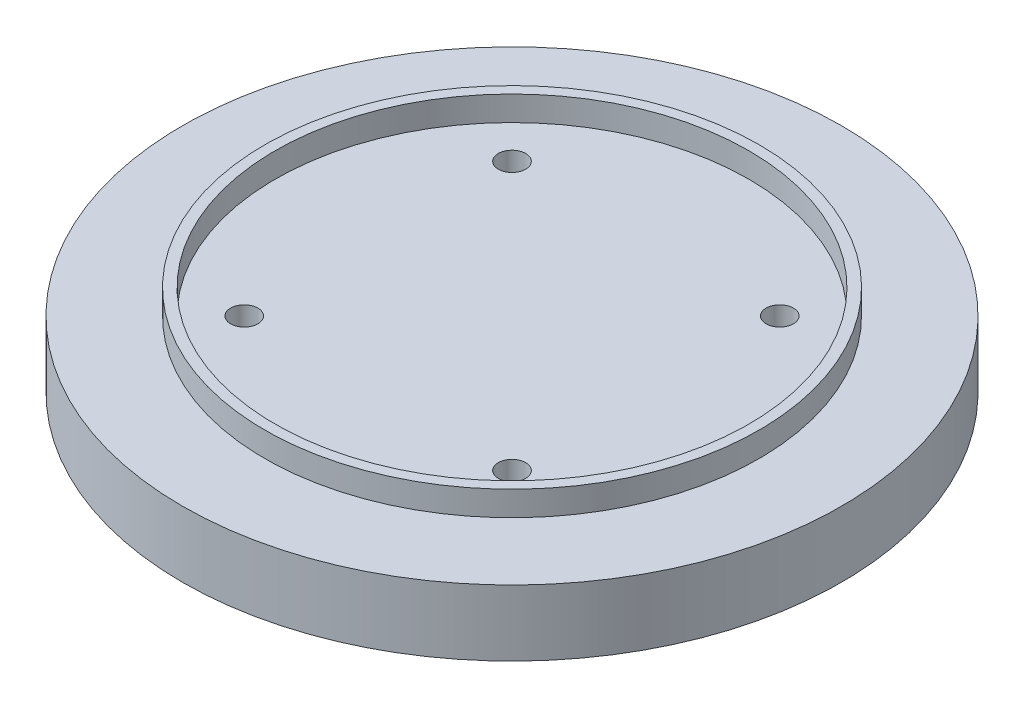
from build123d import *

# Parameters (mm, degrees)
SKETCH1_R                   = 101.6
BOSS_EXTRUDE1_DEPTH         = 10.16
F_3_8_24_TAPPED_HOLE2_D     = 8.4328
F_3_8_24_TAPPED_HOLE2_DEPTH = 13.462
F_3_8_24_TAPPED_HOLE2_TIP   = 2.533468714
F_3_8_24_TAPPED_HOLE1_D     = 8.4328
F_3_8_24_TAPPED_HOLE1_DEPTH = 14.224
F_3_8_24_TAPPED_HOLE1_TIP   = 2.533468714
SKETCH2_R                   = 76.2
SKETCH2_R_2                 = 73.025
BOSS_EXTRUDE2_DEPTH         = 7.62


with BuildPart() as part:
    # Sketch1 → Boss-Extrude1 (new, symmetric)
    with BuildSketch(Plane(origin=(0, 0, 0), x_dir=(1, 0, 0), z_dir=(0, 1, 0))):
        with Locations(Location((0, 0, 0), (0, 0, 270))):
            Circle(SKETCH1_R)
    extrude(amount=BOSS_EXTRUDE1_DEPTH, both=True)

    # 3/8-24 Tapped Hole2
    with Locations(Plane(origin=(0, 10.16, 0), x_dir=(1, 0, 0), z_dir=(0, 1, 0))):
        with Locations((-41.275, 41.275), (41.275, 41.275), (41.275, -41.275), (-41.275, -41.275)):
            Hole(F_3_8_24_TAPPED_HOLE2_D / 2, depth=F_3_8_24_TAPPED_HOLE2_DEPTH)
            with Locations((0, 0, -(F_3_8_24_TAPPED_HOLE2_DEPTH + F_3_8_24_TAPPED_HOLE2_TIP / 2))):  # 118° drill point
                Cone(0, F_3_8_24_TAPPED_HOLE2_D / 2, F_3_8_24_TAPPED_HOLE2_TIP, mode=Mode.SUBTRACT)

    # 3/8-24 Tapped Hole1
    with Locations(Plane(origin=(0, -10.16, 0), x_dir=(-1, 0, 0), z_dir=(0, -1, 0))):
        with Locations((50.8, -50.8), (-50.8, -50.8), (-50.8, 50.8), (50.8, 50.8)):
            Hole(F_3_8_24_TAPPED_HOLE1_D / 2, depth=F_3_8_24_TAPPED_HOLE1_DEPTH)
            with Locations((0, 0, -(F_3_8_24_TAPPED_HOLE1_DEPTH + F_3_8_24_TAPPED_HOLE1_TIP / 2))):  # 118° drill point
                Cone(0, F_3_8_24_TAPPED_HOLE1_D / 2, F_3_8_24_TAPPED_HOLE1_TIP, mode=Mode.SUBTRACT)

    # Sketch2 → Boss-Extrude2 (add)
    with BuildSketch(Plane(origin=(0, 10.16, 0), x_dir=(1, 0, 0), z_dir=(0, 1, 0))):
        with Locations(Location((0, 0, 0), (0, 0, 90))):
            Circle(SKETCH2_R)
        with Locations(Location((0, 0, 0), (0, 0, 90))):
            Circle(SKETCH2_R_2, mode=Mode.SUBTRACT)
    extrude(amount=BOSS_EXTRUDE2_DEPTH)


solid = part.part
